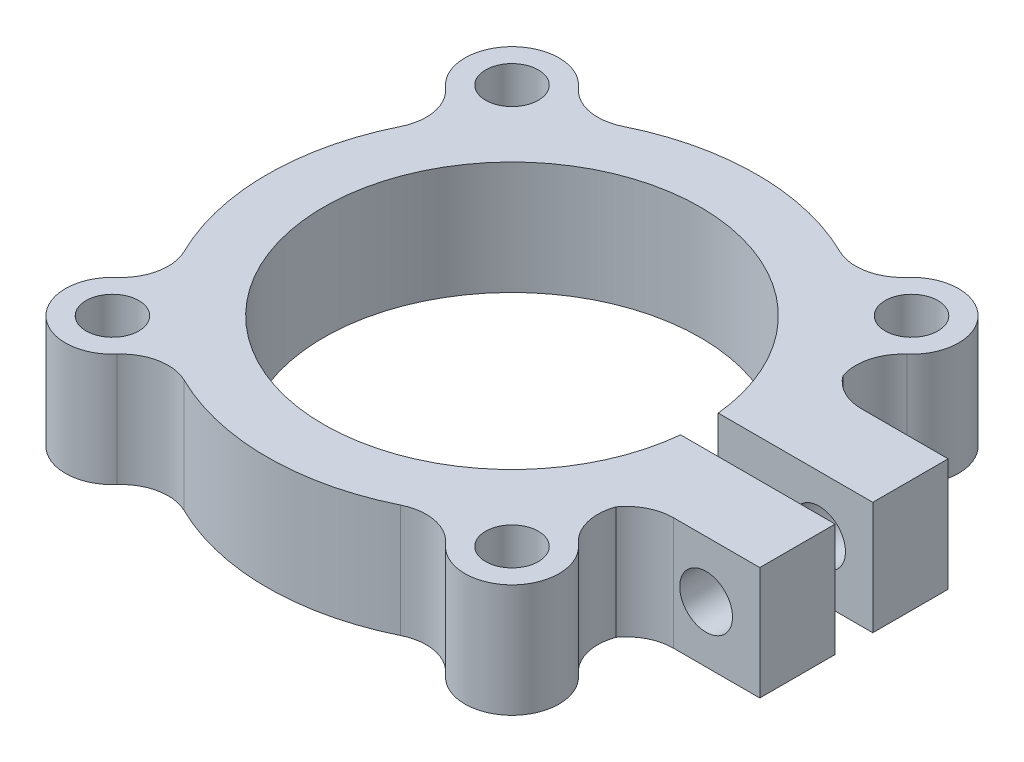
from build123d import *

# Parameters (mm, degrees)
BOSS_EXTRUDE1_DEPTH              = 7.62
CUT_EXTRUDE1_DEPTH               = 30.441514138
SKETCH3_W                        = 12.7
SKETCH3_H                        = 7.62
F_5_CLEARANCE_HOLE1_D            = 3.556
F_36_0_1065_DIAMETER_HOLE1_D     = 2.7051
F_36_0_1065_DIAMETER_HOLE1_DEPTH = 5.08
F_5_CLEARANCE_HOLE2_D            = 3.556
F_5_CLEARANCE_HOLE2_DEPTH        = 22.995384182


with BuildPart() as part:
    # Sketch1 → Boss-Extrude1 (new body)
    with BuildSketch(Plane(origin=(0, 7.62, 0), x_dir=(1, 0, 0), z_dir=(0, 1, 0))):
        with BuildLine():
            Line((23.057960451, -6.35), (23.057960451, 6.35))
            Line((23.057960451, 6.35), (17.227118157, 6.35))
            ThreePointArc((17.227118157, 6.35), (15.786457002, 6.695667846), (14.659490486, 7.657404449))
            ThreePointArc((14.659490486, 7.657404449), (14.589471792, 9.508848608), (15.564771332, 11.084138707))
            ThreePointArc((15.564771332, 11.084138707), (15.715448212, 15.715448212), (11.084138707, 15.564771332))
            ThreePointArc((11.084138707, 15.564771332), (9.317430783, 14.545190239), (7.295007228, 14.810907114))
            ThreePointArc((7.295007228, 14.810907114), (0, 16.51), (-7.295007228, 14.810907114))
            ThreePointArc((-7.295007228, 14.810907114), (-9.317430783, 14.545190239), (-11.084138707, 15.564771332))
            ThreePointArc((-11.084138707, 15.564771332), (-15.715448212, 15.715448212), (-15.564771332, 11.084138707))
            ThreePointArc((-15.564771332, 11.084138707), (-14.545190239, 9.317430783), (-14.810907114, 7.295007228))
            ThreePointArc((-14.810907114, 7.295007228), (-16.51, 0), (-14.810907114, -7.295007228))
            ThreePointArc((-14.810907114, -7.295007228), (-14.545190239, -9.317430783), (-15.564771332, -11.084138707))
            ThreePointArc((-15.564771332, -11.084138707), (-15.715448212, -15.715448212), (-11.084138707, -15.564771332))
            ThreePointArc((-11.084138707, -15.564771332), (-9.317430783, -14.545190239), (-7.295007228, -14.810907114))
            ThreePointArc((-7.295007228, -14.810907114), (0, -16.51), (7.295007228, -14.810907114))
            ThreePointArc((7.295007228, -14.810907114), (9.317430783, -14.545190239), (11.084138707, -15.564771332))
            ThreePointArc((11.084138707, -15.564771332), (15.715448212, -15.715448212), (15.564771332, -11.084138707))
            ThreePointArc((15.564771332, -11.084138707), (14.589471792, -9.508848608), (14.659490486, -7.657404449))
            ThreePointArc((14.659490486, -7.657404449), (15.786457002, -6.695667846), (17.227118157, -6.35))
            Line((17.227118157, -6.35), (23.057960451, -6.35))
        make_face()
    extrude(amount=-BOSS_EXTRUDE1_DEPTH)

    # Sketch2 → Cut-Extrude1 (cut, through all)
    with BuildSketch(Plane.XZ):
        with BuildLine():
            Line((23.057960451, -1.27), (23.057960451, 1.27))
            Line((23.057960451, 1.27), (12.636340451, 1.27))
            ThreePointArc((12.636340451, 1.27), (12.7, 0), (12.636340451, -1.27))
            Line((12.636340451, -1.27), (23.057960451, -1.27))
        make_face()
    extrude(amount=-CUT_EXTRUDE1_DEPTH, mode=Mode.SUBTRACT)

    # Sketch3 → Cut-Revolve1 (revolve, cut)
    with BuildSketch(Plane.XY):
        with Locations((6.35, 3.81)):
            Rectangle(SKETCH3_W, SKETCH3_H)
    revolve(axis=Axis((0, 7.62, 0), (0, -1, 0)), mode=Mode.SUBTRACT)

    # #5 Clearance Hole1 (through all)
    with Locations(Plane(origin=(0, 7.62, 0), x_dir=(1, 0, 0), z_dir=(0, 1, 0))):
        with Locations((13.470384182, -13.470384182), (-13.470384182, -13.470384182), (-13.470384182, 13.470384182), (13.470384182, 13.470384182)):
            Hole(F_5_CLEARANCE_HOLE1_D / 2)

    # #36 (0.1065) Diameter Hole1
    with Locations(Plane(origin=(0, 0, -6.35), x_dir=(-1, 0, 0), z_dir=(0, 0, -1))):
        with Locations((-19.438793191, 3.81)):
            Hole(F_36_0_1065_DIAMETER_HOLE1_D / 2, depth=F_36_0_1065_DIAMETER_HOLE1_DEPTH)

    # #5 Clearance Hole2
    with Locations(Plane.XY.offset(6.35)):
        with Locations((19.438793191, 3.81)):
            Hole(F_5_CLEARANCE_HOLE2_D / 2, depth=F_5_CLEARANCE_HOLE2_DEPTH)


solid = part.part
